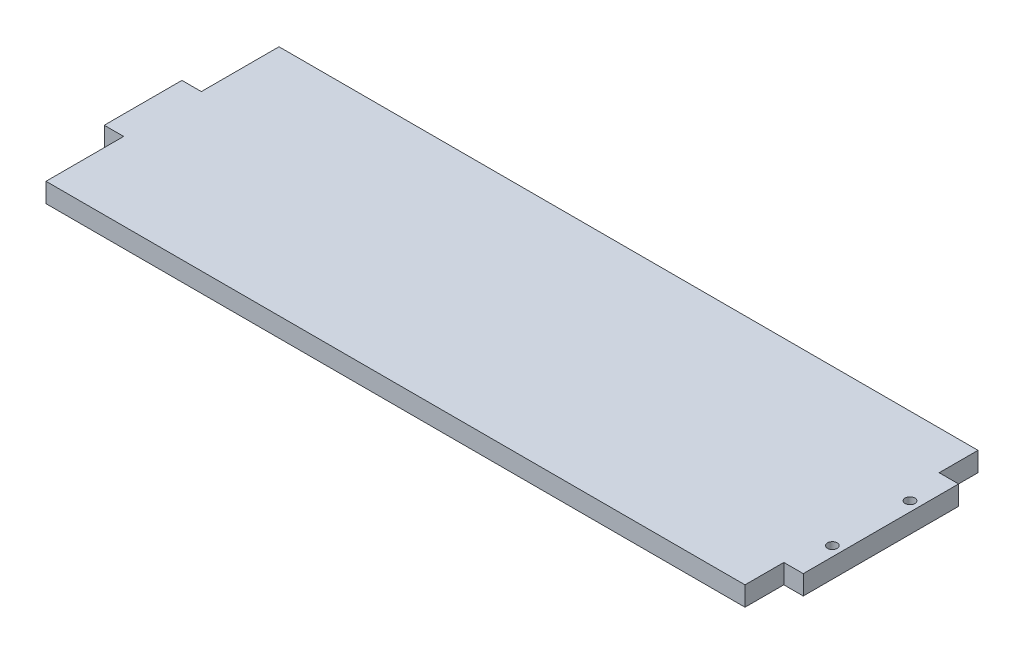
from build123d import *

# Parameters (mm, degrees)
SKETCH1_R           = 1.5875
BOSS_EXTRUDE1_DEPTH = 6.35


with BuildPart() as part:
    # Sketch1 → Boss-Extrude1 (new body)
    with BuildSketch(Plane(origin=(0, 0, 0), x_dir=(1, 0, 0), z_dir=(0, 1, 0))):
        Polygon((-75.214775388, -28.322289224), (153.385224612, -28.322289224), (153.385224612, -41.022289224), (159.735224612, -41.022289224), (159.735224612, -66.422289224), (159.735224612, -91.822289224), (153.385224612, -91.822289224), (153.385224612, -104.522289224), (-75.214775388, -104.522289224), (-75.214775388, -79.122289224), (-81.564775388, -79.122289224), (-81.564775388, -53.722289224), (-75.214775388, -53.722289224), align=None)
        with Locations(Location((156.560224612, -53.722289224, 0), (0, 0, 270))):
            Circle(SKETCH1_R, mode=Mode.SUBTRACT)
        with Locations(Location((156.560224612, -79.122289224, 0), (0, 0, 270))):
            Circle(SKETCH1_R, mode=Mode.SUBTRACT)
    extrude(amount=BOSS_EXTRUDE1_DEPTH)


solid = part.part
